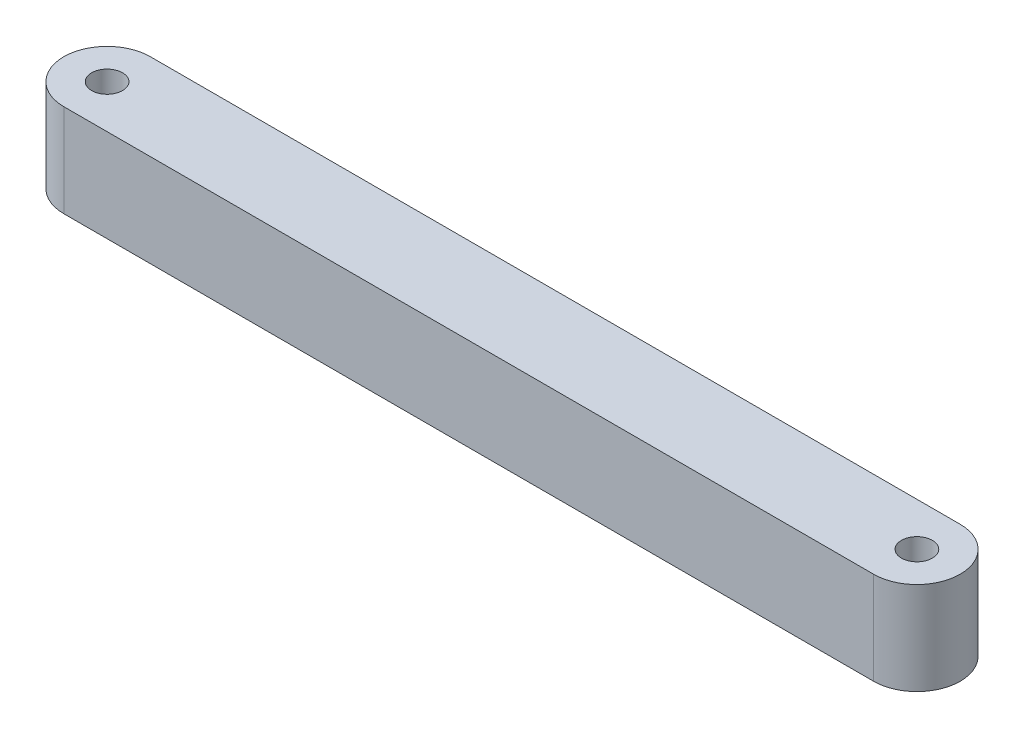
from build123d import *

# Parameters (mm, degrees)
SKETCH1_R           = 7
SKETCH1_R_2         = 2.5
BOSS_EXTRUDE1_DEPTH = 15


with BuildPart() as part:
    # Sketch1 → Boss-Extrude1 (new body)
    # profile 1 of 3: a face of its own
    with BuildSketch(Plane(origin=(0, 0, 0), x_dir=(1, 0, 0), z_dir=(0, 1, 0))):
        with BuildLine():
            Line((0, 7), (-131, 7))
            ThreePointArc((-131, 7), (-126.050252532, 4.949747468), (-124, 0))
            ThreePointArc((-124, 0), (-126.050252532, -4.949747468), (-131, -7))
            Line((-131, -7), (-55.118468675, -7))
            Line((-55.118468675, -7), (0, -7))
            ThreePointArc((0, -7), (-7, 0), (0, 7))
        make_face()
    # profile 2 of 3: a face of its own
    with BuildSketch(Plane(origin=(0, 0, 0), x_dir=(1, 0, 0), z_dir=(0, 1, 0))):
        with Locations((-131, 0)):
            Circle(SKETCH1_R)
        with Locations(Location((-131, 0, 0), (0, 0, 270))):
            Circle(SKETCH1_R_2, mode=Mode.SUBTRACT)
    # profile 3 of 3: a face of its own
    with BuildSketch(Plane(origin=(0, 0, 0), x_dir=(1, 0, 0), z_dir=(0, 1, 0))):
        Circle(SKETCH1_R)
        with Locations(Location((0, 0, 0), (0, 0, 270))):
            Circle(SKETCH1_R_2, mode=Mode.SUBTRACT)
    extrude(amount=BOSS_EXTRUDE1_DEPTH)


solid = part.part
